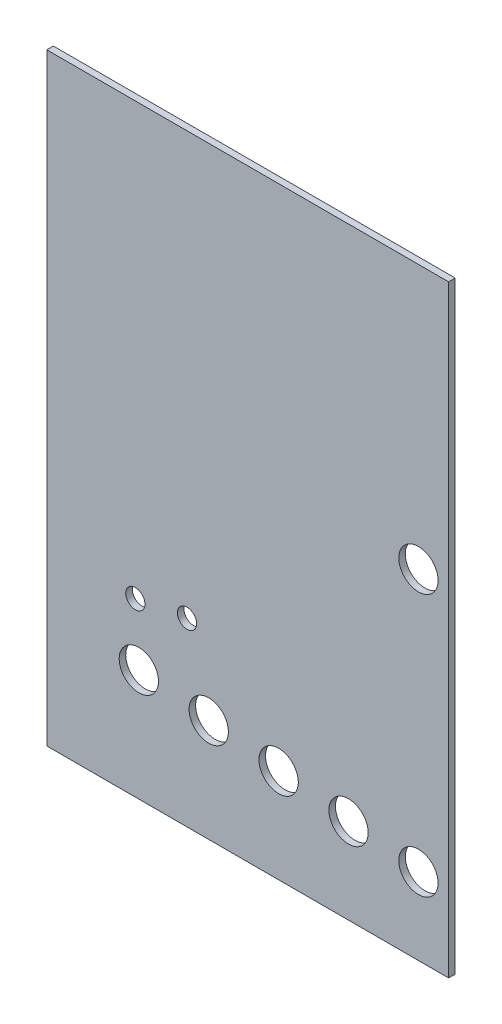
from build123d import *

# Parameters (mm, degrees)
SKETCH1_W           = 292.1
SKETCH1_H           = 438.15
SKETCH1_R           = 7
SKETCH1_R_2         = 14.2875
BOSS_EXTRUDE1_DEPTH = 4.7625
SKETCH2_R           = 14.2875
CUT_EXTRUDE3_DEPTH  = 10.668


with BuildPart() as part:
    # Sketch1 → Boss-Extrude1 (new body)
    with BuildSketch(Plane.XY):
        with Locations((146.05, -219.075)):
            Rectangle(SKETCH1_W, SKETCH1_H)
        with Locations(Location((101.925695163, -306.813385495, 0), (0, 0, 180))):
            Circle(SKETCH1_R, mode=Mode.SUBTRACT)
        with Locations(Location((64.374426387, -313.256382727, 0), (0, 0, 180))):
            Circle(SKETCH1_R, mode=Mode.SUBTRACT)
        with Locations(Location((66.914426387, -356.944382727, 0), (0, 0, 180))):
            Circle(SKETCH1_R_2, mode=Mode.SUBTRACT)
        with Locations(Location((117.714426387, -363.294382727, 0), (0, 0, 180))):
            Circle(SKETCH1_R_2, mode=Mode.SUBTRACT)
        with Locations(Location((168.514426387, -369.644382727, 0), (0, 0, 180))):
            Circle(SKETCH1_R_2, mode=Mode.SUBTRACT)
        with Locations(Location((219.314426387, -375.994382727, 0), (0, 0, 180))):
            Circle(SKETCH1_R_2, mode=Mode.SUBTRACT)
        with Locations(Location((270.114426387, -382.344382727, 0), (0, 0, 180))):
            Circle(SKETCH1_R_2, mode=Mode.SUBTRACT)
    extrude(amount=BOSS_EXTRUDE1_DEPTH)

    # Sketch2 → Cut-Extrude3 (cut)
    with BuildSketch(Plane.XY.offset(4.7625)):
        with Locations((270.114426387, -191.844382727)):
            Circle(SKETCH2_R)
    extrude(amount=-CUT_EXTRUDE3_DEPTH, mode=Mode.SUBTRACT)


solid = part.part
